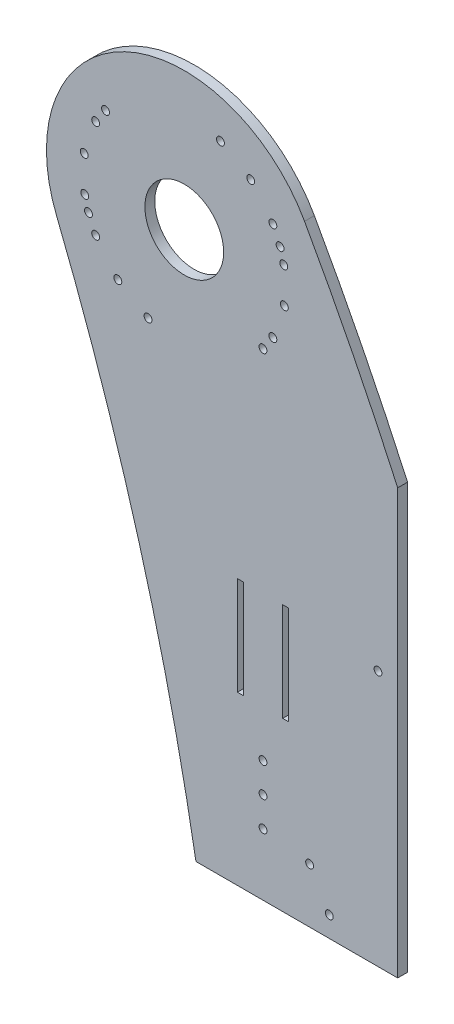
from build123d import *

# Parameters (mm, degrees)
SKETCH_1_R          = 2
SKETCH_1_W          = 3
SKETCH_1_H          = 50
SKETCH_1_R_2        = 70
SKETCH_1_R_3        = 20
EXTRUDE_1_DEPTH     = 5
SKETCH_2_R          = 2
CUT_EXTRUDE_1_DEPTH = 697.437362582
SKETCH_3_R          = 2
CUT_EXTRUDE_2_DEPTH = 697.437362582
SKETCH_4_R          = 2
CUT_EXTRUDE_3_DEPTH = 10


with BuildPart() as part:
    # 草图1 → 凸台-拉伸1 (new body)
    # profile 1 of 2: a face of its own
    with BuildSketch(Plane.XY):
        with BuildLine():
            ThreePointArc((-184.975195398, 573.957266214), (-108.724882678, 291.977251427), (-100, 0))
            Line((-100, 0), (-100, -10))
            Line((-100, -10), (-91, -10))
            Line((-91, -10), (-91, 11))
            Line((-91, 11), (-69, 11))
            Line((-69, 11), (-69, -10))
            Line((-69, -10), (100, -10))
            Line((100, -10), (100, 0))
            ThreePointArc((100, 0), (62.740102222, 327.663103245), (-58.911784918, 634.179379428))
            ThreePointArc((-58.911784918, 634.179379428), (-52.264577008, 617.661043914), (-50, 600))
            ThreePointArc((-50, 600), (-106.738470636, 531.267679808), (-184.975195398, 573.957266214))
        make_face()
        with Locations((-50, 0)):
            Circle(SKETCH_1_R, mode=Mode.SUBTRACT)
        Circle(SKETCH_1_R, mode=Mode.SUBTRACT)
        with Locations((50, 0)):
            Circle(SKETCH_1_R, mode=Mode.SUBTRACT)
        with Locations((-91.5, 435)):
            Rectangle(SKETCH_1_W, SKETCH_1_H, mode=Mode.SUBTRACT)
        with Locations((-68.5, 435)):
            Rectangle(SKETCH_1_W, SKETCH_1_H, mode=Mode.SUBTRACT)
    # profile 2 of 2: a face of its own
    with BuildSketch(Plane.XY):
        with Locations((-120, 600)):
            Circle(SKETCH_1_R_2)
        with Locations((-120, 600)):
            Circle(SKETCH_1_R_3, mode=Mode.SUBTRACT)
    extrude(amount=EXTRUDE_1_DEPTH)

    # 草图2 → 切除-拉伸1 (cut, through all)
    with BuildSketch(Plane(origin=(0, 0, 0), x_dir=(-1, 0, 0), z_dir=(0, 0, -1))):
        with Locations((80, 386.410161514)):
            Circle(SKETCH_2_R)
        with Locations((80, 371.410161514)):
            Circle(SKETCH_2_R)
        with Locations((80, 356.410161514)):
            Circle(SKETCH_2_R)
        with Locations((56.339745962, 352.749907476)):
            Circle(SKETCH_2_R)
        with Locations((46.339745962, 335.4293994)):
            Circle(SKETCH_2_R)
        with Locations((26.339745962, 300.788383249)):
            Circle(SKETCH_2_R)
        with Locations((6.339745962, 266.147367097)):
            Circle(SKETCH_2_R)
        with Locations((-13.660254038, 231.506350946)):
            Circle(SKETCH_2_R)
        with Locations((80, 76.410161514)):
            Circle(SKETCH_2_R)
        with Locations((80, 116.410161514)):
            Circle(SKETCH_2_R)
        with Locations((80, 236.410161514)):
            Circle(SKETCH_2_R)
        with Locations((80, 276.410161514)):
            Circle(SKETCH_2_R)
        with Locations((80, 316.410161514)):
            Circle(SKETCH_2_R)
    extrude(amount=-CUT_EXTRUDE_1_DEPTH, mode=Mode.SUBTRACT)

    # 草图3 → 切除-拉伸2 (cut, through all)
    with BuildSketch(Plane.XY.offset(5)):
        with Locations((-165, 625)):
            Circle(SKETCH_3_R)
        with Locations((-75, 625)):
            Circle(SKETCH_3_R)
        with Locations((-75, 575)):
            Circle(SKETCH_3_R)
        with Locations((-165, 575)):
            Circle(SKETCH_3_R)
        with Locations((-168.657553327, 583.19397417)):
            Circle(SKETCH_3_R)
        with Locations((-159.975144444, 632.43436182)):
            Circle(SKETCH_3_R)
        with Locations((-71.342446673, 616.80602583)):
            Circle(SKETCH_3_R)
        with Locations((-80.024855556, 567.56563818)):
            Circle(SKETCH_3_R)
        with Locations((-86.264335648, 638.883221969)):
            Circle(SKETCH_3_R)
        with Locations((-69.163328481, 591.89859093)):
            Circle(SKETCH_3_R)
        with Locations((-153.735664352, 561.116778031)):
            Circle(SKETCH_3_R)
        with Locations((-170.836671519, 608.10140907)):
            Circle(SKETCH_3_R)
        with Locations((-101.597690302, 648.076553514)):
            Circle(SKETCH_3_R)
        with Locations((-69.458309817, 609.774331358)):
            Circle(SKETCH_3_R)
        with Locations((-138.402309698, 551.923446486)):
            Circle(SKETCH_3_R)
        with Locations((-170.541690183, 590.225668642)):
            Circle(SKETCH_3_R)
    extrude(amount=-CUT_EXTRUDE_2_DEPTH, mode=Mode.SUBTRACT)


with BuildPart() as body_2:
    # Split Bodies 1: the piece on the far side of the plane
    add(part.part)
    split(bisect_by=Plane(origin=(0, 325, 0), x_dir=(0, 0, -1), z_dir=(0, -1, 0)), keep=Keep.BOTTOM)

    # 草图4 → 切除-拉伸3 (cut)
    with BuildSketch(Plane.XY.offset(5)):
        with Locations((-21.595687559, 455)):
            Circle(SKETCH_4_R)
        with BuildLine():
            Line((-11.595687559, 325), (-11.595687559, 540.604962521))
            ThreePointArc((-11.595687559, 540.604962521), (30.836385122, 434.518144234), (63.404312441, 325))
            Line((63.404312441, 325), (-11.595687559, 325))
        make_face()
    extrude(amount=-CUT_EXTRUDE_3_DEPTH, mode=Mode.SUBTRACT)


with BuildPart() as part_1:
    add(part.part)

    # Split Bodies 1
    split(bisect_by=Plane(origin=(0, 325, 0), x_dir=(0, 0, -1), z_dir=(0, -1, 0)), keep=Keep.TOP)


solid = body_2.part
